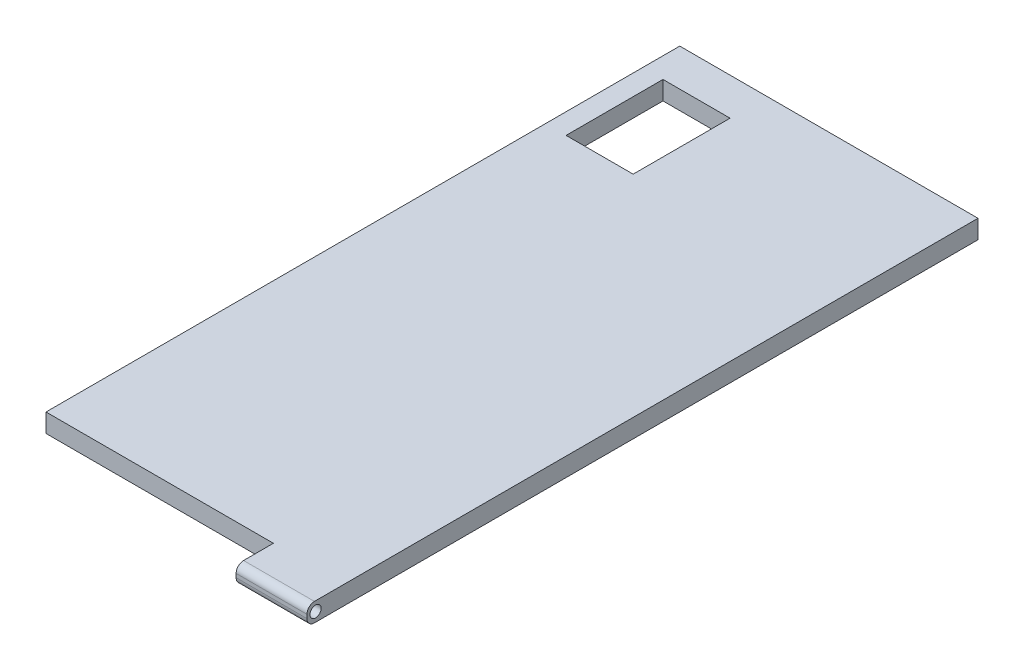
from build123d import *

# Parameters (mm, degrees)
SKETCH4_W           = 40
SKETCH4_H           = 85
BOSS_EXTRUDE1_DEPTH = 2.5
SKETCH5_W           = 9.5
SKETCH5_H           = 5
BOSS_EXTRUDE2_DEPTH = 2.5
SKETCH12_W          = 9
SKETCH12_H          = 13
CUT_EXTRUDE1_DEPTH  = 5
FILLET4_R           = 1
FILLET5_R           = 1
SKETCH13_R          = 0.75
CUT_EXTRUDE2_DEPTH  = 10


with BuildPart() as part:
    # Sketch4 → Boss-Extrude1 (new body)
    with BuildSketch(Plane(origin=(0, 0, 0), x_dir=(1, 0, 0), z_dir=(0, 1, 0))):
        Rectangle(SKETCH4_W, SKETCH4_H)
    extrude(amount=BOSS_EXTRUDE1_DEPTH)

    # Sketch5 → Boss-Extrude2 (add)
    with BuildSketch(Plane(origin=(0, 2.5, 0), x_dir=(1, 0, 0), z_dir=(0, 1, 0))):
        with Locations((15.25, -45)):
            Rectangle(SKETCH5_W, SKETCH5_H)
    extrude(amount=-BOSS_EXTRUDE2_DEPTH)

    # Sketch12 → Cut-Extrude1 (cut)
    with BuildSketch(Plane(origin=(0, 2.5, 0), x_dir=(1, 0, 0), z_dir=(0, 1, 0))):
        with Locations((-12.75, 31)):
            Rectangle(SKETCH12_W, SKETCH12_H)
    extrude(amount=-CUT_EXTRUDE1_DEPTH, mode=Mode.SUBTRACT)

    # Fillet4
    fillet4_edges = [part.edges().sort_by_distance(p)[0] for p in [
        (15.25, 2.5, 47.5),
    ]]
    fillet(fillet4_edges, radius=FILLET4_R)

    # Fillet5
    fillet5_edges = [part.edges().sort_by_distance(p)[0] for p in [
        (15.25, 0, 47.5),
    ]]
    fillet(fillet5_edges, radius=FILLET5_R)

    # Sketch13 → Cut-Extrude2 (cut)
    with BuildSketch(Plane.ZY.offset(-10.5)):
        with Locations((46.35, 1.25)):
            Circle(SKETCH13_R)
    extrude(amount=-CUT_EXTRUDE2_DEPTH, mode=Mode.SUBTRACT)


solid = part.part
